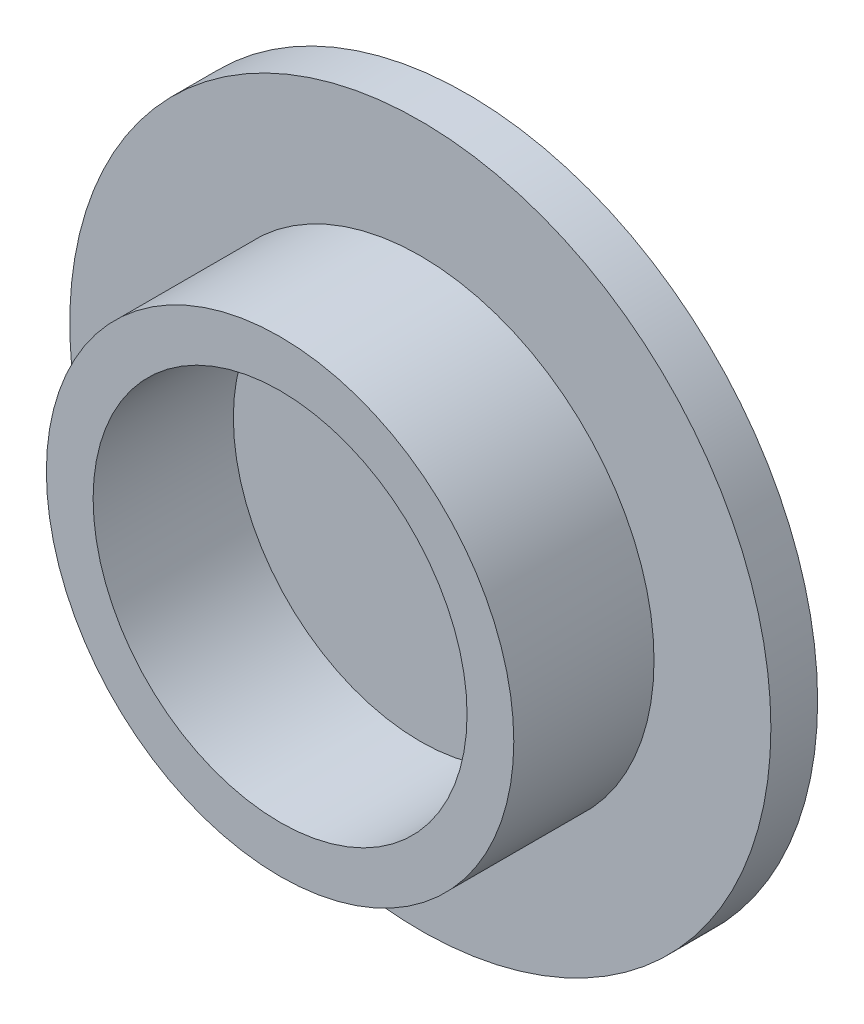
from build123d import *

# Parameters (mm, degrees)
SKETCH2_R           = 50
SKETCH2_R_2         = 40
BOSS_EXTRUDE1_DEPTH = 30
SKETCH3_R           = 75
BOSS_EXTRUDE2_DEPTH = 10


with BuildPart() as part:
    # Sketch2 → Boss-Extrude1 (new body)
    with BuildSketch(Plane.XY):
        Circle(SKETCH2_R)
        Circle(SKETCH2_R_2, mode=Mode.SUBTRACT)
    extrude(amount=BOSS_EXTRUDE1_DEPTH)


with BuildPart() as body_2:
    # Sketch3 → Boss-Extrude2 (new body)
    with BuildSketch(Plane.XY):
        Circle(SKETCH3_R)
    extrude(amount=-BOSS_EXTRUDE2_DEPTH)


solid = Compound([part.part, body_2.part])
